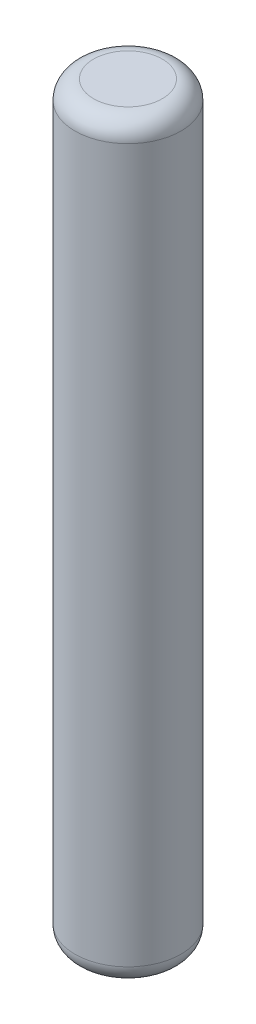
from build123d import *

# Parameters (mm, degrees)
SKETCH1_R           = 2.84
BOSS_EXTRUDE1_DEPTH = 40.18
FILLET1_R           = 1
FILLET2_R           = 1


with BuildPart() as part:
    # Sketch1 → Boss-Extrude1 (new body)
    with BuildSketch(Plane(origin=(0, 0, 0), x_dir=(1, 0, 0), z_dir=(0, 1, 0))):
        with Locations(Location((0, 0, 0), (0, 0, 270))):
            Circle(SKETCH1_R)
    extrude(amount=BOSS_EXTRUDE1_DEPTH)

    # Fillet1
    fillet1_edges = [part.edges().sort_by_distance(p)[0] for p in [
        (0, 40.18, -2.84),
    ]]
    fillet(fillet1_edges, radius=FILLET1_R)

    # Fillet2
    fillet2_edges = [part.edges().sort_by_distance(p)[0] for p in [
        (0, 0, -2.84),
    ]]
    fillet(fillet2_edges, radius=FILLET2_R)


solid = part.part
